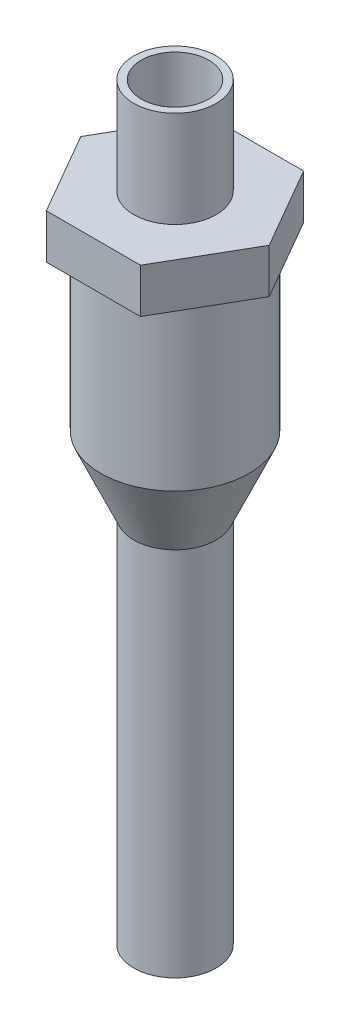
from build123d import *

# Parameters (mm, degrees)
BOSS_EXTRUDE1_DEPTH = 6
SKETCH3_R           = 4.55625
CUT_EXTRUDE1_DEPTH  = 99


with BuildPart() as part:
    # Sketch1 → Revolve1 (revolve)
    with BuildSketch(Plane.XY, mode=Mode.PRIVATE) as revolve1_sk:
        Polygon((0, 13), (5.55625, 13), (5.55625, 0), (10, 0), (10, -28), (5.55625, -38), (5.55625, -88), (0, -88), align=None)
    revolve(revolve1_sk.sketch.rotate(Axis((0, 13, 0), (0, -1, 0)), 180), axis=Axis((0, 13, 0), (0, -1, 0)))

    # Sketch2 → Boss-Extrude1 (add)
    with BuildSketch(Plane(origin=(0, 0, 0), x_dir=(1, 0, 0), z_dir=(0, 1, 0))):
        Polygon((12.701705922, 0), (6.350852961, 11), (-6.350852961, 11), (-12.701705922, 0), (-6.350852961, -11), (6.350852961, -11), align=None)
    extrude(amount=-BOSS_EXTRUDE1_DEPTH)

    # Sketch3 → Cut-Extrude1 (cut)
    with BuildSketch(Plane(origin=(0, 13, 0), x_dir=(1, 0, 0), z_dir=(0, 1, 0))):
        with Locations(Location((0, 0, 0), (0, 0, 180))):
            Circle(SKETCH3_R)
    extrude(amount=-CUT_EXTRUDE1_DEPTH, mode=Mode.SUBTRACT)


solid = part.part
